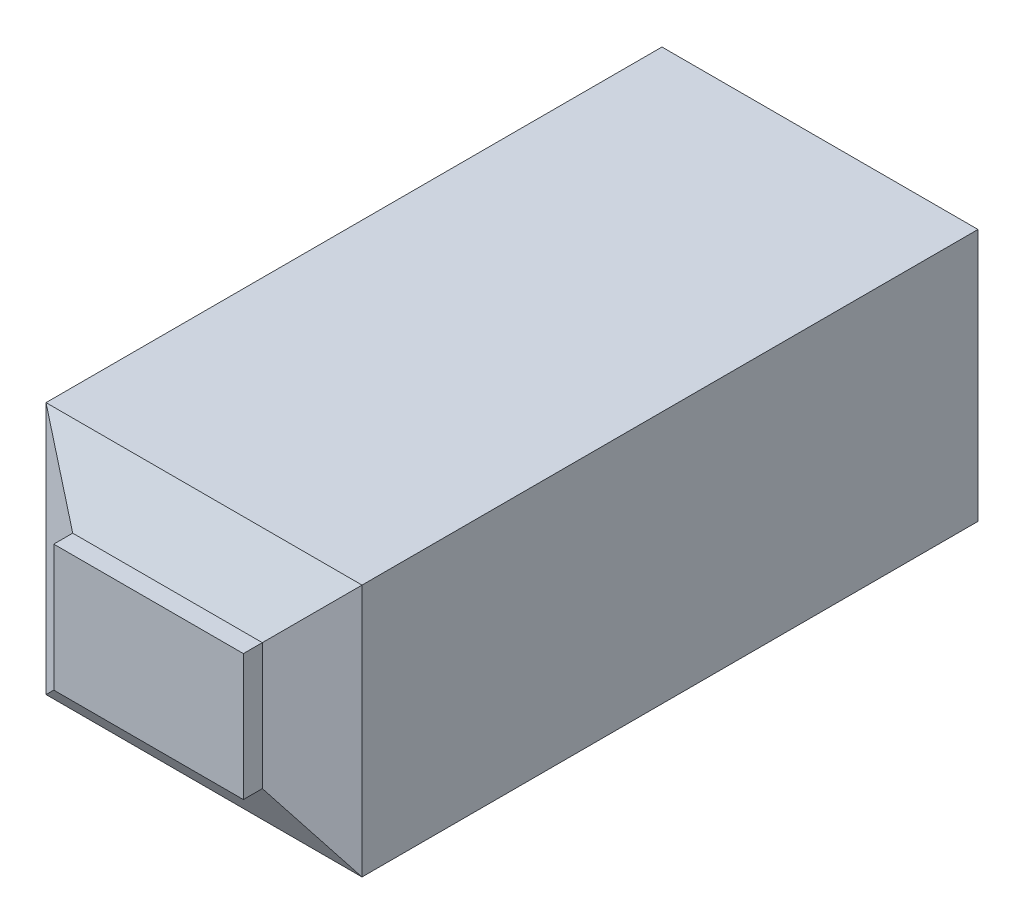
from build123d import *

# Parameters (mm, degrees)
SKETCH1_W           = 50
SKETCH1_H           = 40
BOSS_EXTRUDE1_DEPTH = 115


with BuildPart() as part:
    # Sketch1 → Boss-Extrude1 (new body)
    with BuildSketch(Plane.XY):
        Rectangle(SKETCH1_W, SKETCH1_H)
    extrude(amount=-BOSS_EXTRUDE1_DEPTH)

    # Cut-Sweep1: sweep along a path in Sketch2
    with BuildLine(Plane.XY) as cut_sweep1_path:
        Line((-15, -10), (15, -10))
        Line((15, -10), (15, 10))
        Line((15, 10), (-15, 10))
        Line((-15, 10), (-15, -10))
    # Sketch3 → Cut-Sweep1 (sweep, cut)
    with BuildSketch(Plane(origin=(15, 10, 0), x_dir=(0, 0, -1), z_dir=(1, 0, 0))):
        Polygon((8.773502692, 10), (0, 10), (0, 0), (3, 0), align=None)
    cut_sweep1 = sweep(path=cut_sweep1_path.line, transition=Transition.RIGHT, mode=Mode.SUBTRACT)

    # Mirror1: Cut-Sweep1 across plane
    add(cut_sweep1.mirror(Plane.XY.offset(-57.5)), mode=Mode.SUBTRACT)


solid = part.part
